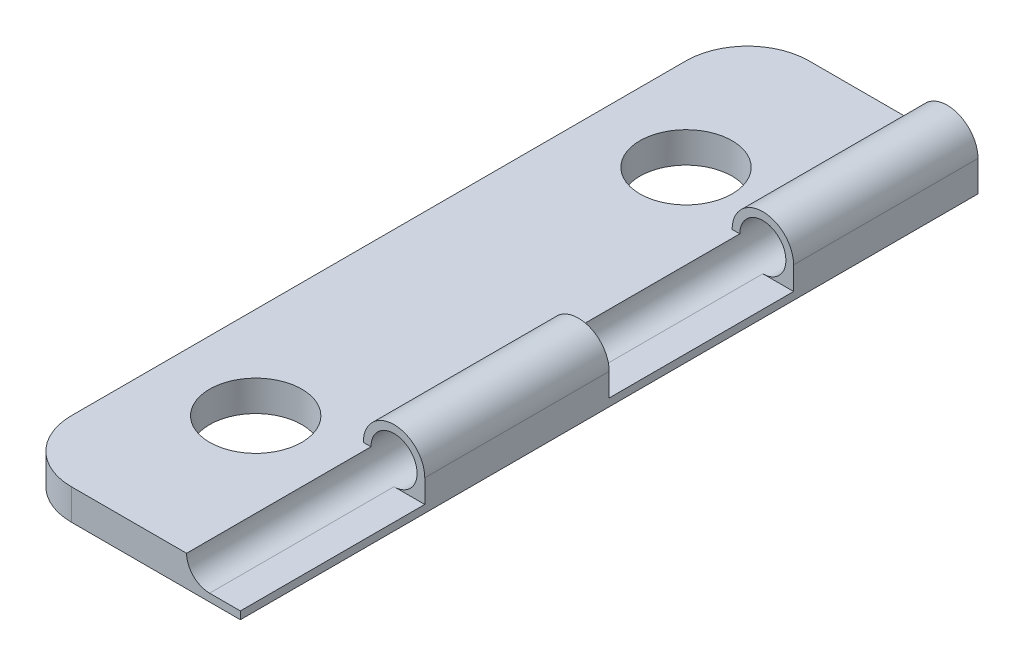
from build123d import *

# Parameters (mm, degrees)
CROQUIS1_W              = 7.5
CROQUIS1_H              = 24
SALIENTE_EXTRUIR1_DEPTH = 1
CROQUIS2_R              = 1
SALIENTE_EXTRUIR2_DEPTH = 6
CROQUIS3_R              = 1
SALIENTE_EXTRUIR3_DEPTH = 6
CROQUIS4_R              = 0.75
CORTAR_EXTRUIR1_DEPTH   = 24
REDONDEO1_R             = 2
CROQUIS5_R              = 1.5
CORTAR_EXTRUIR2_DEPTH   = 18
CORTAR_EXTRUIR3_DEPTH   = 6
CORTAR_EXTRUIR4_DEPTH   = 6


with BuildPart() as part:
    # Croquis1 → Saliente-Extruir1 (new body)
    with BuildSketch(Plane(origin=(0, 0, 0), x_dir=(1, 0, 0), z_dir=(0, 1, 0))):
        with Locations((3.75, 12)):
            Rectangle(CROQUIS1_W, CROQUIS1_H)
    extrude(amount=SALIENTE_EXTRUIR1_DEPTH)

    # Croquis2 → Saliente-Extruir2 (add)
    with BuildSketch(Plane(origin=(0, 0, -24), x_dir=(-1, 0, 0), z_dir=(0, 0, -1))):
        with Locations((-6.5, 1)):
            Circle(CROQUIS2_R)
    extrude(amount=-SALIENTE_EXTRUIR2_DEPTH)

    # Croquis3 → Saliente-Extruir3 (add)
    with BuildSketch(Plane.XY.offset(-12)):
        with Locations((6.5, 1)):
            Circle(CROQUIS3_R)
    extrude(amount=SALIENTE_EXTRUIR3_DEPTH)

    # Croquis4 → Cortar-Extruir1 (cut)
    with BuildSketch(Plane(origin=(0, 0, -24), x_dir=(-1, 0, 0), z_dir=(0, 0, -1))):
        with Locations((-6.5, 1)):
            Circle(CROQUIS4_R)
    extrude(amount=-CORTAR_EXTRUIR1_DEPTH, mode=Mode.SUBTRACT)

    # Redondeo1
    redondeo1_edges = [part.edges().sort_by_distance(p)[0] for p in [
        (0, 0.5, -24),
        (0, 0.5, 0),
    ]]
    fillet(redondeo1_edges, radius=REDONDEO1_R)

    # Croquis5 → Cortar-Extruir2 (cut)
    with BuildSketch(Plane(origin=(0, 1, 0), x_dir=(1, 0, 0), z_dir=(0, 1, 0))):
        with Locations(Location((3, 19, 0), (0, 0, 270))):
            Circle(CROQUIS5_R)
        with Locations(Location((3, 5, 0), (0, 0, 270))):
            Circle(CROQUIS5_R)
    extrude(amount=-CORTAR_EXTRUIR2_DEPTH, mode=Mode.SUBTRACT)

    # Croquis6 → Cortar-Extruir3 (cut)
    with BuildSketch(Plane.XY):
        Polygon((6.5, 0.25), (7.5, 0.25), (7.5, 1), (7.25, 1), align=None)
    extrude(amount=-CORTAR_EXTRUIR3_DEPTH, mode=Mode.SUBTRACT)

    # Croquis7 → Cortar-Extruir4 (cut)
    with BuildSketch(Plane(origin=(0, 0, -12), x_dir=(-1, 0, 0), z_dir=(0, 0, -1))):
        Polygon((-6.5, 0.25), (-7.5, 0.25), (-7.5, 1), (-6.800248099, 1), align=None)
    extrude(amount=CORTAR_EXTRUIR4_DEPTH, mode=Mode.SUBTRACT)


solid = part.part
